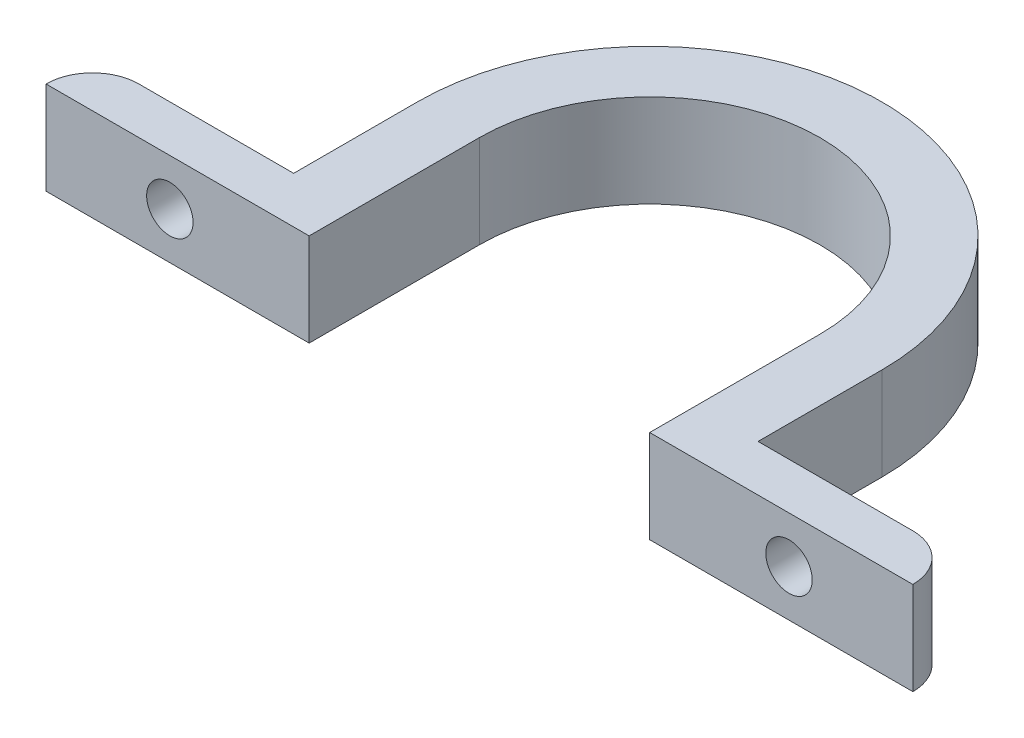
from build123d import *

# Parameters (mm, degrees)
BOSS_EXTRU_2_DEPTH      = 6
ESQUISSE3_R             = 1.5
ENL_V_MAT_EXTRU_1_DEPTH = 48.391982444


with BuildPart() as part:
    # Esquisse1 → Boss.-Extru.2 (new body)
    with BuildSketch(Plane(origin=(0, 0, 0), x_dir=(1, 0, 0), z_dir=(0, 1, 0))):
        with BuildLine():
            Line((24, 0.5), (24, -10.5))
            Line((24, -10.5), (41, -10.5))
            ThreePointArc((41, -10.5), (40.121320344, -8.378679656), (38, -7.5))
            Line((38, -7.5), (28, -7.5))
            Line((28, -7.5), (28, 0.5))
            ThreePointArc((28, 0.5), (13, 15.5), (-2, 0.5))
            Line((-2, 0.5), (-2, -7.5))
            Line((-2, -7.5), (-12, -7.5))
            ThreePointArc((-12, -7.5), (-14.121320344, -8.378679656), (-15, -10.5))
            Line((-15, -10.5), (2, -10.5))
            Line((2, -10.5), (2, 0.5))
            ThreePointArc((2, 0.5), (13, 11.5), (24, 0.5))
        make_face()
    extrude(amount=BOSS_EXTRU_2_DEPTH)

    # Esquisse3 → Enlèv. mat.-Extru.1 (cut, through all)
    with BuildSketch(Plane(origin=(0, 0, 7.5), x_dir=(-1, 0, 0), z_dir=(0, 0, -1))):
        with Locations((-33, 3)):
            Circle(ESQUISSE3_R)
        with Locations(Location((7, 3, 0), (0, 0, 180))):
            Circle(ESQUISSE3_R)
    extrude(amount=-ENL_V_MAT_EXTRU_1_DEPTH, mode=Mode.SUBTRACT)


solid = part.part
